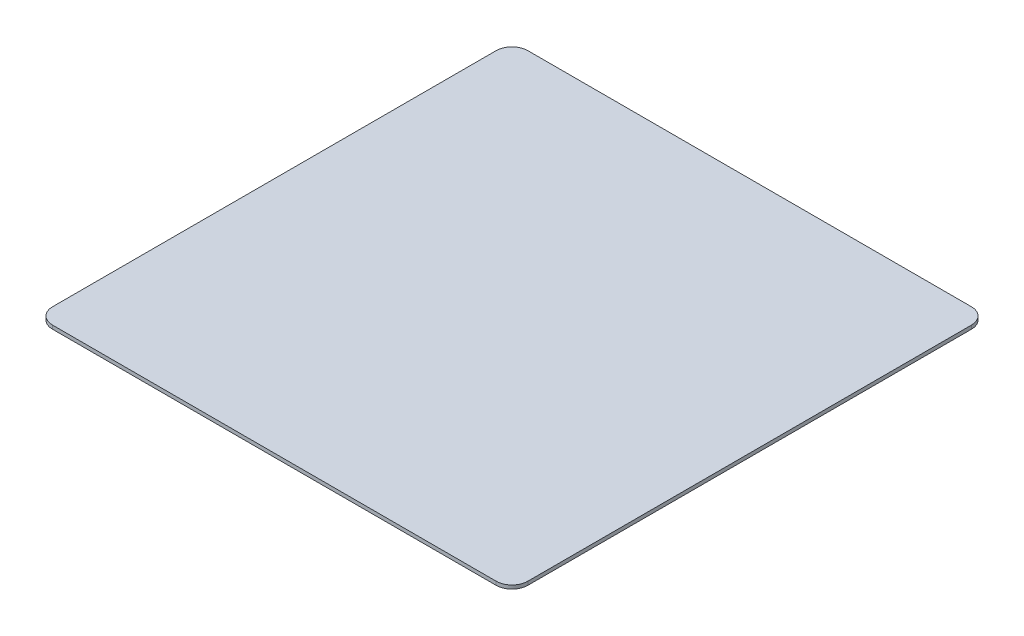
from build123d import *

# Parameters (mm, degrees)
SKETCH1_W           = 300
SKETCH1_H           = 300
BOSS_EXTRUDE1_DEPTH = 2.286
FILLET1_R           = 10


with BuildPart() as part:
    # Sketch1 → Boss-Extrude1 (new body)
    with BuildSketch(Plane(origin=(0, 0, 0), x_dir=(1, 0, 0), z_dir=(0, 1, 0))):
        Rectangle(SKETCH1_W, SKETCH1_H)
    extrude(amount=BOSS_EXTRUDE1_DEPTH)

    # Fillet1
    fillet1_edges = [part.edges().sort_by_distance(p)[0] for p in [
        (-150, 1.143, -150),
        (150, 1.143, -150),
        (150, 1.143, 150),
        (-150, 1.143, 150),
    ]]
    fillet(fillet1_edges, radius=FILLET1_R)


solid = part.part
